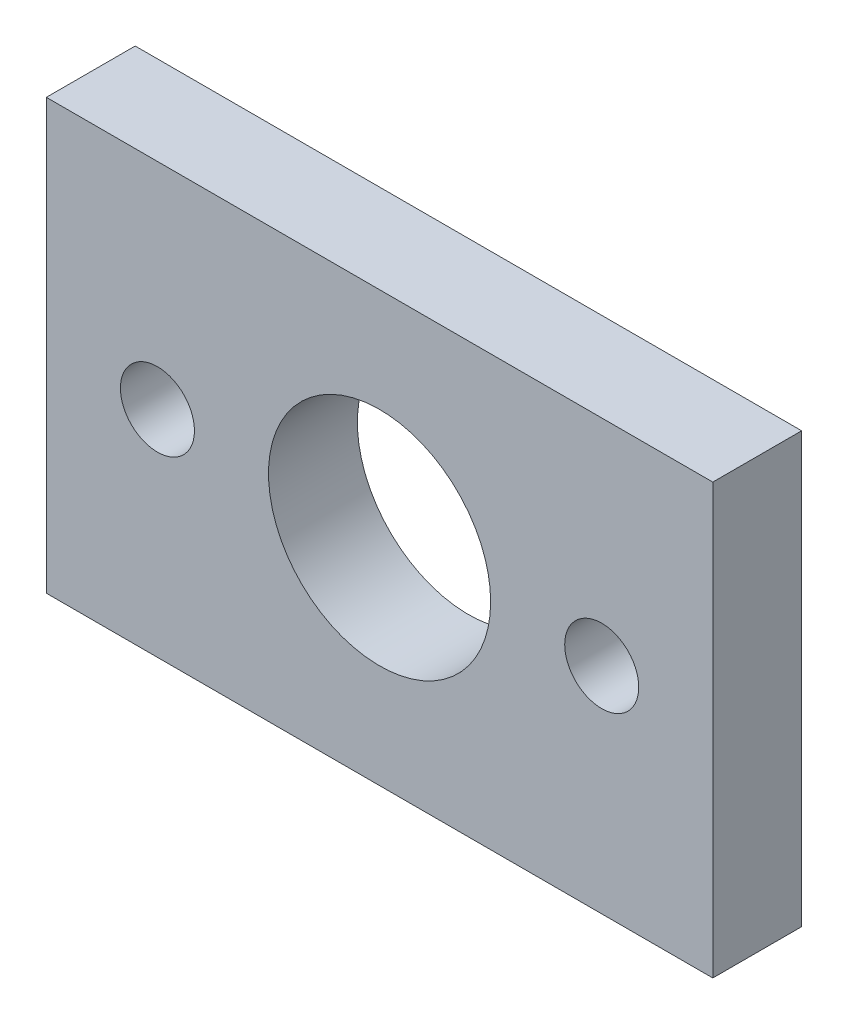
from build123d import *

# Parameters (mm, degrees)
SKETCH1_W           = 45
SKETCH1_H           = 29
SKETCH1_R           = 7.5
SKETCH1_R_2         = 2.5
BOSS_EXTRUDE1_DEPTH = 6


with BuildPart() as part:
    # Sketch1 → Boss-Extrude1 (new body)
    with BuildSketch(Plane.XY):
        with Locations((22.5, 14.5)):
            Rectangle(SKETCH1_W, SKETCH1_H)
        with Locations((22.5, 14.5)):
            Circle(SKETCH1_R, mode=Mode.SUBTRACT)
        with Locations((7.5, 14.5)):
            Circle(SKETCH1_R_2, mode=Mode.SUBTRACT)
        with Locations(Location((37.5, 14.5, 0), (0, 0, 180))):
            Circle(SKETCH1_R_2, mode=Mode.SUBTRACT)
    extrude(amount=BOSS_EXTRUDE1_DEPTH)


solid = part.part
